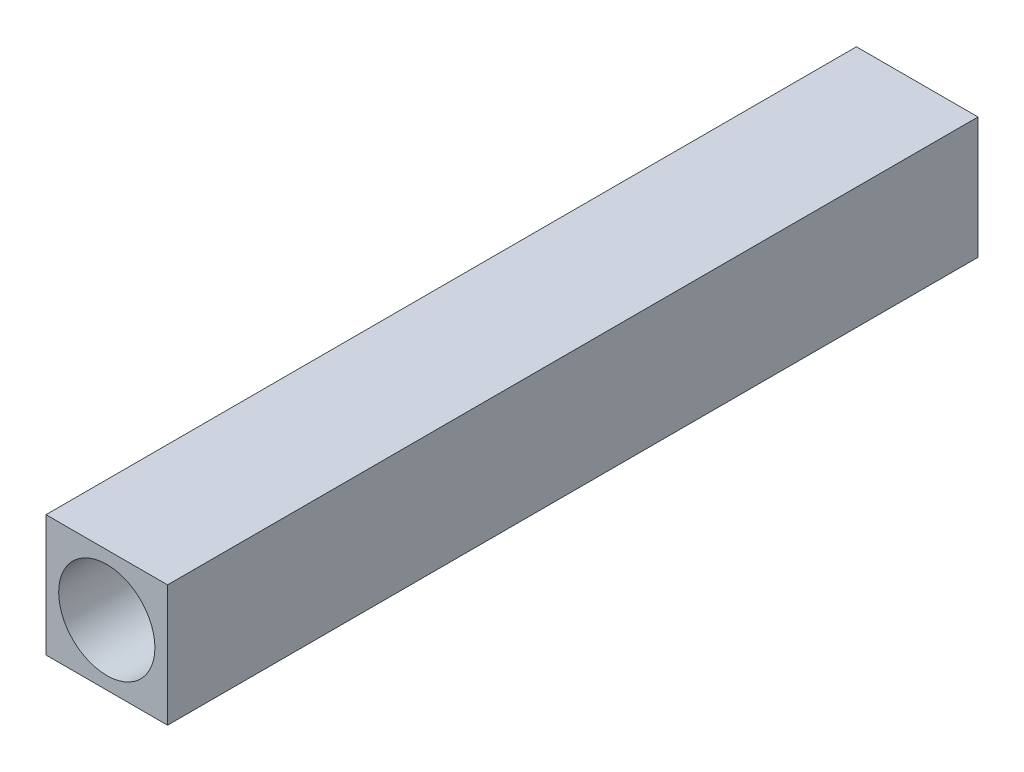
from build123d import *

# Parameters (mm, degrees)
SKETCH1_R                = 12.192
SKETCH1_R_2              = 9.652
MAIN_INNER_TUBE_DEPTH    = 162.56
SKETCH3_R                = 9.652
SKETCH3_R_2              = 8.636
INNER_BLOCKING_LIP_DEPTH = 6.35
SKETCH6_W                = 24.384
SKETCH6_H                = 24.384
SKETCH6_R                = 9.652
RECTANGLE_OUTSIDE_DEPTH  = 162.56


with BuildPart() as part:
    # Sketch1 → Main Inner Tube (new body)
    with BuildSketch(Plane.XY):
        Circle(SKETCH1_R)
        Circle(SKETCH1_R_2, mode=Mode.SUBTRACT)
    extrude(amount=MAIN_INNER_TUBE_DEPTH)

    # Sketch3 → Inner Blocking Lip (add)
    with BuildSketch(Plane(origin=(0, 0, 0), x_dir=(-1, 0, 0), z_dir=(0, 0, -1))):
        Circle(SKETCH3_R)
        Circle(SKETCH3_R_2, mode=Mode.SUBTRACT)
    extrude(amount=-INNER_BLOCKING_LIP_DEPTH)

    # Sketch6 → Rectangle Outside (add, through all)
    with BuildSketch(Plane.XY.offset(162.56)):
        Rectangle(SKETCH6_W, SKETCH6_H)
        with Locations(Location((0, 0, 0), (0, 0, 180))):
            Circle(SKETCH6_R, mode=Mode.SUBTRACT)
    extrude(amount=-RECTANGLE_OUTSIDE_DEPTH)


solid = part.part
